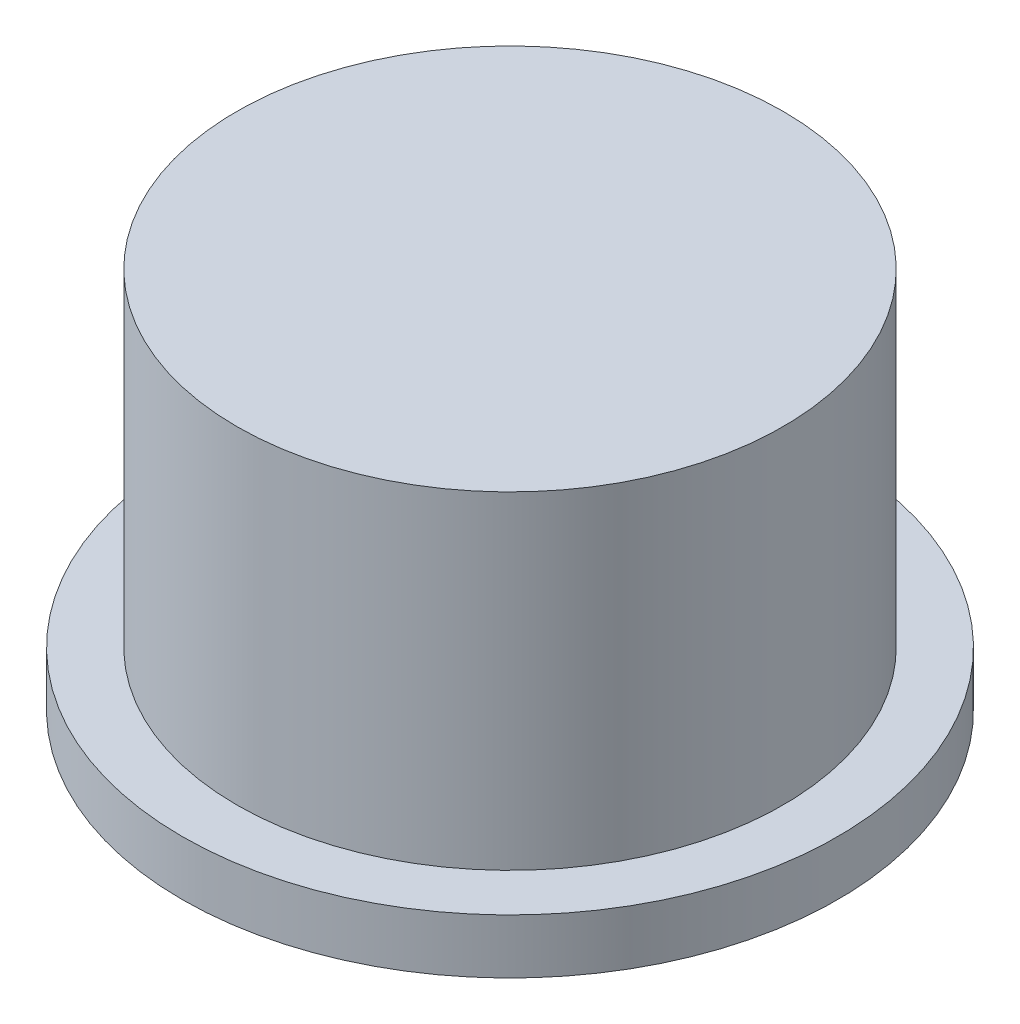
from build123d import *

# Parameters (mm, degrees)
SKIZZE1_R                       = 5
AUFSATZ_LINEAR_AUSTRAGEN1_DEPTH = 7
SKIZZE2_R                       = 6
AUFSATZ_LINEAR_AUSTRAGEN2_DEPTH = 1


with BuildPart() as part:
    # Skizze1 → Aufsatz-Linear austragen1 (new body)
    with BuildSketch(Plane(origin=(0, 0, 0), x_dir=(1, 0, 0), z_dir=(0, 1, 0))):
        with Locations(Location((0, 0, 0), (0, 0, 270))):
            Circle(SKIZZE1_R)
    extrude(amount=AUFSATZ_LINEAR_AUSTRAGEN1_DEPTH)

    # Skizze2 → Aufsatz-Linear austragen2 (add)
    with BuildSketch(Plane.XZ):
        with Locations(Location((0, 0, 0), (0, 0, 270))):
            Circle(SKIZZE2_R)
    extrude(amount=-AUFSATZ_LINEAR_AUSTRAGEN2_DEPTH)


solid = part.part
